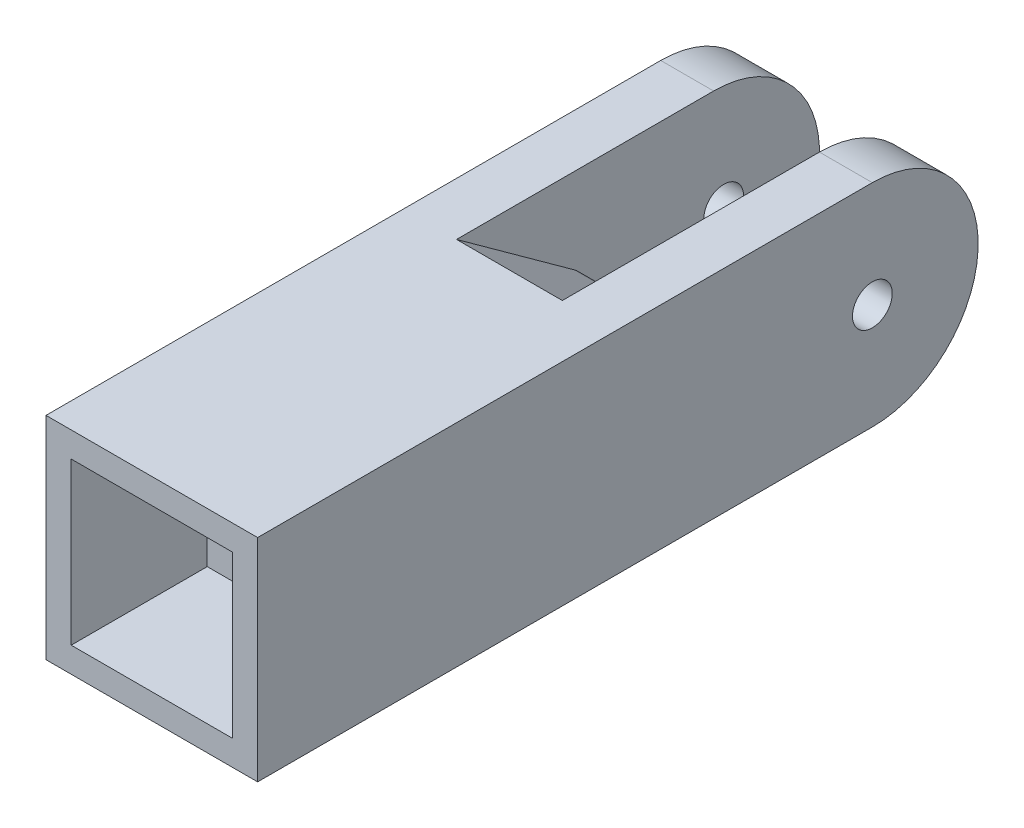
from build123d import *

# Parameters (mm, degrees)
SKETCH2_W           = 42
SKETCH2_H           = 42
BOSS_EXTRUDE1_DEPTH = 100
SKETCH3_W           = 10.5
SKETCH3_H           = 42
BOSS_EXTRUDE2_DEPTH = 22
BOSS_EXTRUDE3_DEPTH = 10.5
BOSS_EXTRUDE4_START = -10.5
BOSS_EXTRUDE4_DEPTH = 10.5
SKETCH6_W           = 32
SKETCH6_H           = 32
CUT_EXTRUDE1_DEPTH  = 27
SKETCH7_R           = 3.95
CUT_EXTRUDE2_DEPTH  = 107.92637654
SKETCH9_R           = 3.95
CUT_EXTRUDE3_DEPTH  = 107.92637654
CUT_EXTRUDE4_DEPTH  = 21
FILLET1_R           = 5


with BuildPart() as part:
    # Sketch2 → Boss-Extrude1 (new body)
    with BuildSketch(Plane.XY):
        Rectangle(SKETCH2_W, SKETCH2_H)
    extrude(amount=BOSS_EXTRUDE1_DEPTH)

    # Sketch3 → Boss-Extrude2 (add)
    with BuildSketch(Plane(origin=(0, 0, 0), x_dir=(-1, 0, 0), z_dir=(0, 0, -1))):
        with Locations((15.75, 0)):
            Rectangle(SKETCH3_W, SKETCH3_H)
        with Locations((-15.75, 0)):
            Rectangle(SKETCH3_W, SKETCH3_H)
    extrude(amount=BOSS_EXTRUDE2_DEPTH)

    # Sketch4 → Boss-Extrude3 (add)
    with BuildSketch(Plane.ZY.offset(21)):
        with BuildLine():
            Line((-22, -21), (-22, 21))
            ThreePointArc((-22, 21), (-43, 0), (-22, -21))
        make_face()
    extrude(amount=-BOSS_EXTRUDE3_DEPTH)

    # Sketch5 → Boss-Extrude4 (add)
    with BuildSketch(Plane(origin=(21, 0, 0), x_dir=(0, 0, -1), z_dir=(1, 0, 0)).offset(BOSS_EXTRUDE4_START)):
        with BuildLine():
            Line((22, 21), (22, -21))
            ThreePointArc((22, -21), (43, 0), (22, 21))
        make_face()
    extrude(amount=BOSS_EXTRUDE4_DEPTH)

    # Sketch6 → Cut-Extrude1 (cut)
    with BuildSketch(Plane.XY.offset(100)):
        Rectangle(SKETCH6_W, SKETCH6_H)
    extrude(amount=-CUT_EXTRUDE1_DEPTH, mode=Mode.SUBTRACT)

    # Sketch7 → Cut-Extrude2 (cut, through all)
    with BuildSketch(Plane.ZY.offset(-10.5)):
        with Locations((-22, 0)):
            Circle(SKETCH7_R)
    extrude(amount=-CUT_EXTRUDE2_DEPTH, mode=Mode.SUBTRACT)

    # Sketch9 → Cut-Extrude3 (cut, through all)
    with BuildSketch(Plane(origin=(-10.5, 0, 0), x_dir=(0, 0, -1), z_dir=(1, 0, 0))):
        with Locations(Location((24, 0, 0), (0, 0, 90))):
            Circle(SKETCH9_R)
    extrude(amount=-CUT_EXTRUDE3_DEPTH, mode=Mode.SUBTRACT)

    # Sketch11 → Cut-Extrude4 (cut)
    with BuildSketch(Plane.ZY.offset(-10.5)):
        Polygon((0, 21), (0, 0), (29.025198915, 21), align=None)
        Polygon((29.025198915, -21), (0, 0), (0, -21), align=None)
    extrude(amount=CUT_EXTRUDE4_DEPTH, mode=Mode.SUBTRACT)

    # Fillet1
    fillet1_edges = [part.edges().sort_by_distance(p)[0] for p in [
        (0, 0, 0),
    ]]
    fillet(fillet1_edges, radius=FILLET1_R)


solid = part.part
